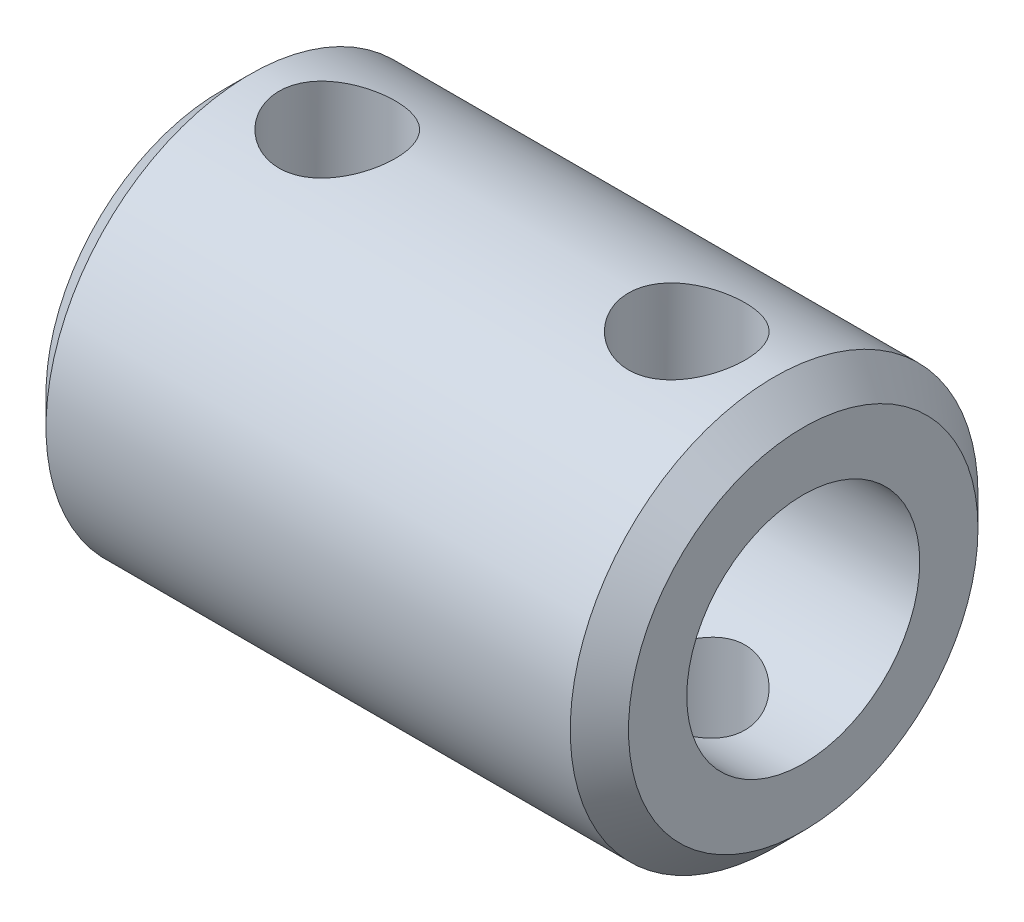
from build123d import *

# Parameters (mm, degrees)
SKETCH1_R               = 7
SKETCH1_R_2             = 4
BOSS_EXTRUDE1_DEPTH     = 10
CUT_EXTRUDE1_DEPTH      = 15.071247279
CUT_EXTRUDE1_DEPTH_BACK = 15.071247279
SKETCH2_R               = 2
CHAMFER1_SIZE           = 1


with BuildPart() as part:
    # Sketch1 → Boss-Extrude1 (new, symmetric)
    with BuildSketch(Plane(origin=(0, 0, 0), x_dir=(0, 0, -1), z_dir=(1, 0, 0))):
        Circle(SKETCH1_R)
        Circle(SKETCH1_R_2, mode=Mode.SUBTRACT)
    extrude(amount=BOSS_EXTRUDE1_DEPTH, both=True)

    # Sketch2 → Cut-Extrude1 (cut, two sides: drawn at the far end of the back side and taken through both)
    with BuildSketch(Plane(origin=(0, 0, 0), x_dir=(1, 0, 0), z_dir=(0, 1, 0)).offset(-CUT_EXTRUDE1_DEPTH_BACK)):
        with Locations((-6, 0)):
            Circle(SKETCH2_R)
        with Locations((6, 0)):
            Circle(SKETCH2_R)
    extrude(amount=CUT_EXTRUDE1_DEPTH + CUT_EXTRUDE1_DEPTH_BACK, mode=Mode.SUBTRACT)

    # Chamfer1
    chamfer1_edges = [part.edges().sort_by_distance(p)[0] for p in [
        (10, 0, 7),
        (-10, 0, 7),
    ]]
    chamfer(chamfer1_edges, length=CHAMFER1_SIZE)


solid = part.part
